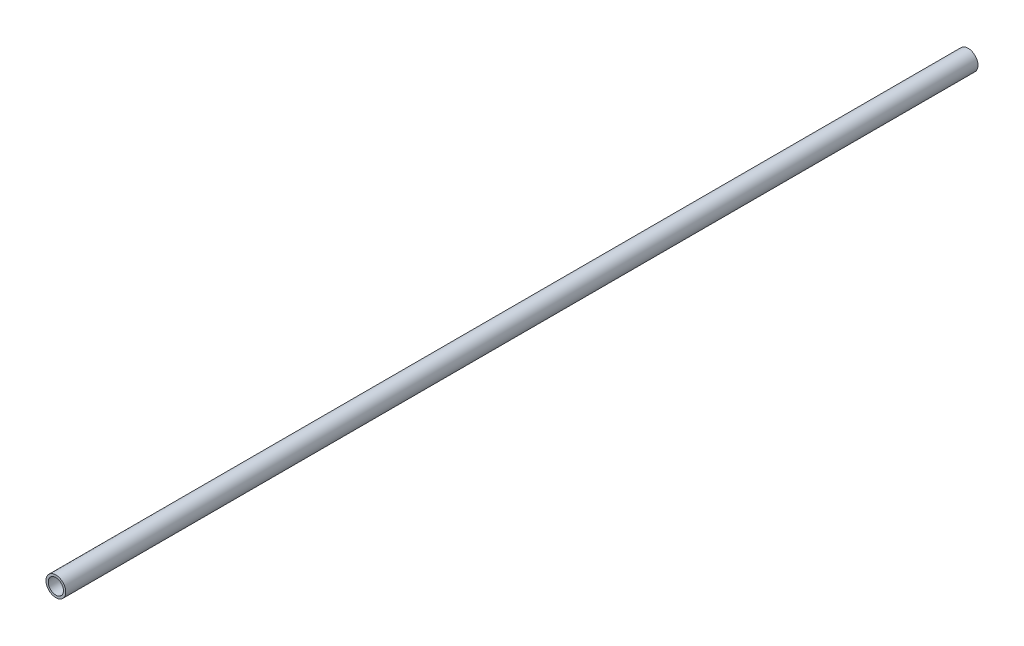
from build123d import *

# Parameters (mm, degrees)
CROQUIS2_R              = 6.5
CROQUIS2_R_2            = 5
SALIENTE_EXTRUIR1_DEPTH = 600


with BuildPart() as part:
    # Croquis2 → Saliente-Extruir1 (new body)
    with BuildSketch(Plane(origin=(0, 0, 0), x_dir=(0, 1, 0), z_dir=(0, 0, 1))):
        with Locations(Location((0, 0, 0), (0, 0, 270))):
            Circle(CROQUIS2_R)
        with Locations(Location((0, 0, 0), (0, 0, 270))):
            Circle(CROQUIS2_R_2, mode=Mode.SUBTRACT)
    extrude(amount=SALIENTE_EXTRUIR1_DEPTH)


solid = part.part
